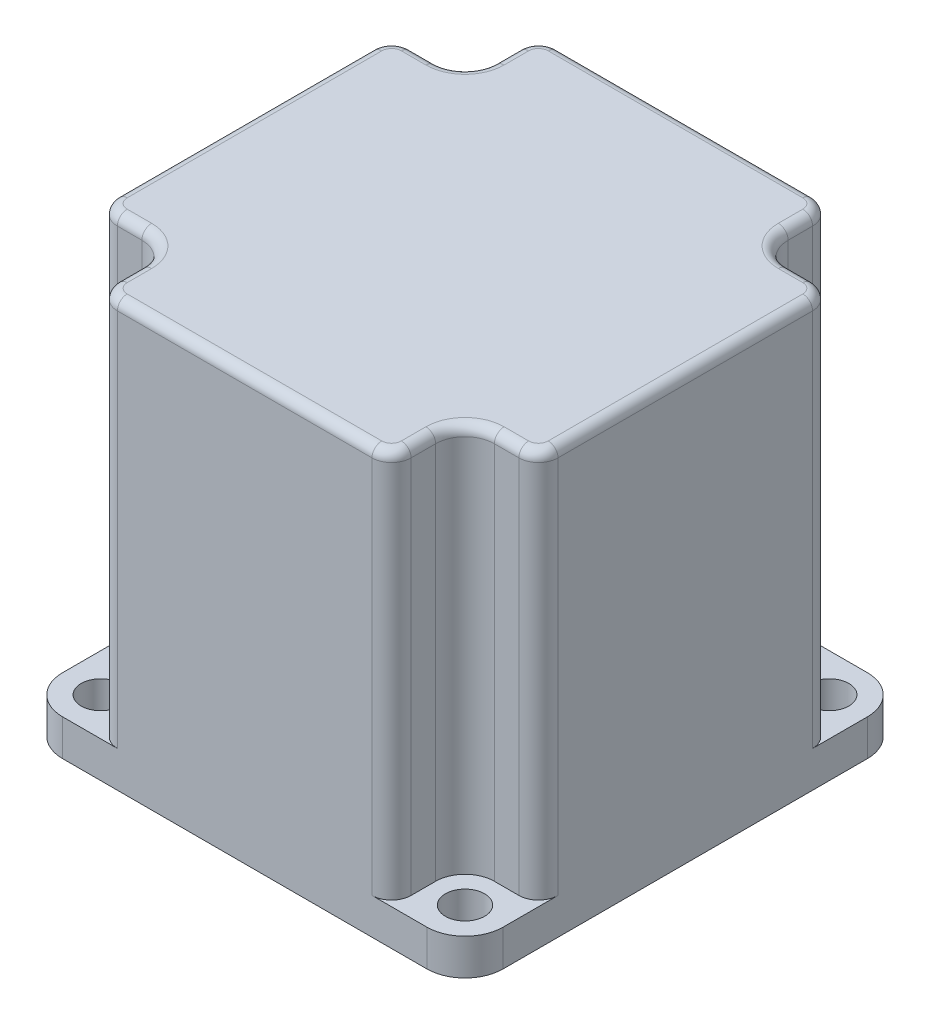
from build123d import *

# Parameters (mm, degrees)
SKETCH1_R           = 2.54
BOSS_EXTRUDE1_DEPTH = 4.699
BOSS_EXTRUDE2_DEPTH = 50.419
FILLET1_R           = 3.81
FILLET2_R           = 2.54
FILLET3_R           = 1.27
SKETCH3_R           = 19.05
BOSS_EXTRUDE3_DEPTH = 1.524
CUT_EXTRUDE1_START  = -6.35
SKETCH5_R           = 22.225
CUT_EXTRUDE1_DEPTH  = 44.45
SKETCH4_R           = 3.175
BOSS_EXTRUDE4_DEPTH = 19.05


with BuildPart() as part:
    # Sketch1 → Boss-Extrude1 (new body)
    with BuildSketch(Plane(origin=(0, 0, 0), x_dir=(1, 0, 0), z_dir=(0, 1, 0))):
        with BuildLine():
            Line((-23.622, 28.575), (23.622, 28.575))
            ThreePointArc((23.622, 28.575), (27.124299887, 27.124299887), (28.575, 23.622))
            Line((28.575, 23.622), (28.575, -23.622))
            ThreePointArc((28.575, -23.622), (27.124299887, -27.124299887), (23.622, -28.575))
            Line((23.622, -28.575), (-23.622, -28.575))
            ThreePointArc((-23.622, -28.575), (-27.124299887, -27.124299887), (-28.575, -23.622))
            Line((-28.575, -23.622), (-28.575, 23.622))
            ThreePointArc((-28.575, 23.622), (-27.124299887, 27.124299887), (-23.622, 28.575))
        make_face()
        with Locations(Location((-23.622, 23.622, 0), (0, 0, 270))):
            Circle(SKETCH1_R, mode=Mode.SUBTRACT)
        with Locations(Location((23.622, 23.622, 0), (0, 0, 270))):
            Circle(SKETCH1_R, mode=Mode.SUBTRACT)
        with Locations(Location((23.622, -23.622, 0), (0, 0, 270))):
            Circle(SKETCH1_R, mode=Mode.SUBTRACT)
        with Locations(Location((-23.622, -23.622, 0), (0, 0, 270))):
            Circle(SKETCH1_R, mode=Mode.SUBTRACT)
    extrude(amount=BOSS_EXTRUDE1_DEPTH)

    # Sketch2 → Boss-Extrude2 (add)
    with BuildSketch(Plane(origin=(0, 4.699, 0), x_dir=(1, 0, 0), z_dir=(0, 1, 0))):
        Polygon((-19.05, -28.575), (-19.05, -19.05), (-28.575, -19.05), (-28.575, 19.05), (-19.05, 19.05), (-19.05, 28.575), (19.05, 28.575), (19.05, 19.05), (28.575, 19.05), (28.575, -19.05), (19.05, -19.05), (19.05, -28.575), align=None)
    extrude(amount=BOSS_EXTRUDE2_DEPTH)

    # Fillet1
    fillet1_edges = [part.edges().sort_by_distance(p)[0] for p in [
        (-19.05, 29.9085, 19.05),
        (-19.05, 29.9085, -19.05),
        (19.05, 29.9085, -19.05),
        (19.05, 29.9085, 19.05),
    ]]
    fillet(fillet1_edges, radius=FILLET1_R)

    # Fillet2
    fillet2_edges = [part.edges().sort_by_distance(p)[0] for p in [
        (28.575, 29.9085, -19.05),
        (19.05, 29.9085, -28.575),
        (28.575, 29.9085, 19.05),
        (-19.05, 29.9085, -28.575),
        (-28.575, 29.9085, -19.05),
        (-19.05, 29.9085, 28.575),
        (-28.575, 29.9085, 19.05),
        (19.05, 29.9085, 28.575),
    ]]
    fillet(fillet2_edges, radius=FILLET2_R)

    # Fillet3
    fillet3_edges = [part.edges().sort_by_distance(p)[0] for p in [
        (24.4475, 55.118, -19.05),
        (28.575, 55.118, 0),
        (0, 55.118, 28.575),
        (19.05, 55.118, 24.4475),
        (0, 55.118, -28.575),
        (-19.05, 55.118, -24.4475),
        (-28.575, 55.118, 0),
        (-24.4475, 55.118, 19.05),
        (18.306051224, 55.118, 27.831051224),
        (-27.831051224, 55.118, 18.306051224),
        (-18.306051224, 55.118, 27.831051224),
        (-27.831051224, 55.118, -18.306051224),
        (-18.306051224, 55.118, -27.831051224),
        (27.831051224, 55.118, 18.306051224),
        (18.306051224, 55.118, -27.831051224),
        (27.831051224, 55.118, -18.306051224),
        (-19.05, 55.118, 24.4475),
        (-24.4475, 55.118, -19.05),
        (19.05, 55.118, -24.4475),
        (24.4475, 55.118, 19.05),
        (-20.165923164, 55.118, 20.165923164),
        (-20.165923164, 55.118, -20.165923164),
        (20.165923164, 55.118, -20.165923164),
        (20.165923164, 55.118, 20.165923164),
    ]]
    fillet(fillet3_edges, radius=FILLET3_R)

    # Sketch3 → Boss-Extrude3 (add)
    with BuildSketch(Plane.XZ):
        with Locations(Location((0, 0, 0), (0, 0, 90))):
            Circle(SKETCH3_R)
    extrude(amount=BOSS_EXTRUDE3_DEPTH)

    # Sketch5 → Cut-Extrude1 (cut)
    with BuildSketch(Plane.XZ.offset(CUT_EXTRUDE1_START)):
        with Locations(Location((0, 0, 0), (0, 0, 270))):
            Circle(SKETCH5_R)
    extrude(amount=-CUT_EXTRUDE1_DEPTH, mode=Mode.SUBTRACT)

    # Sketch4 → Boss-Extrude4 (add)
    with BuildSketch(Plane.XZ.offset(1.524)):
        with Locations(Location((0, 0, 0), (0, 0, 90))):
            Circle(SKETCH4_R)
    extrude(amount=BOSS_EXTRUDE4_DEPTH)


solid = part.part
